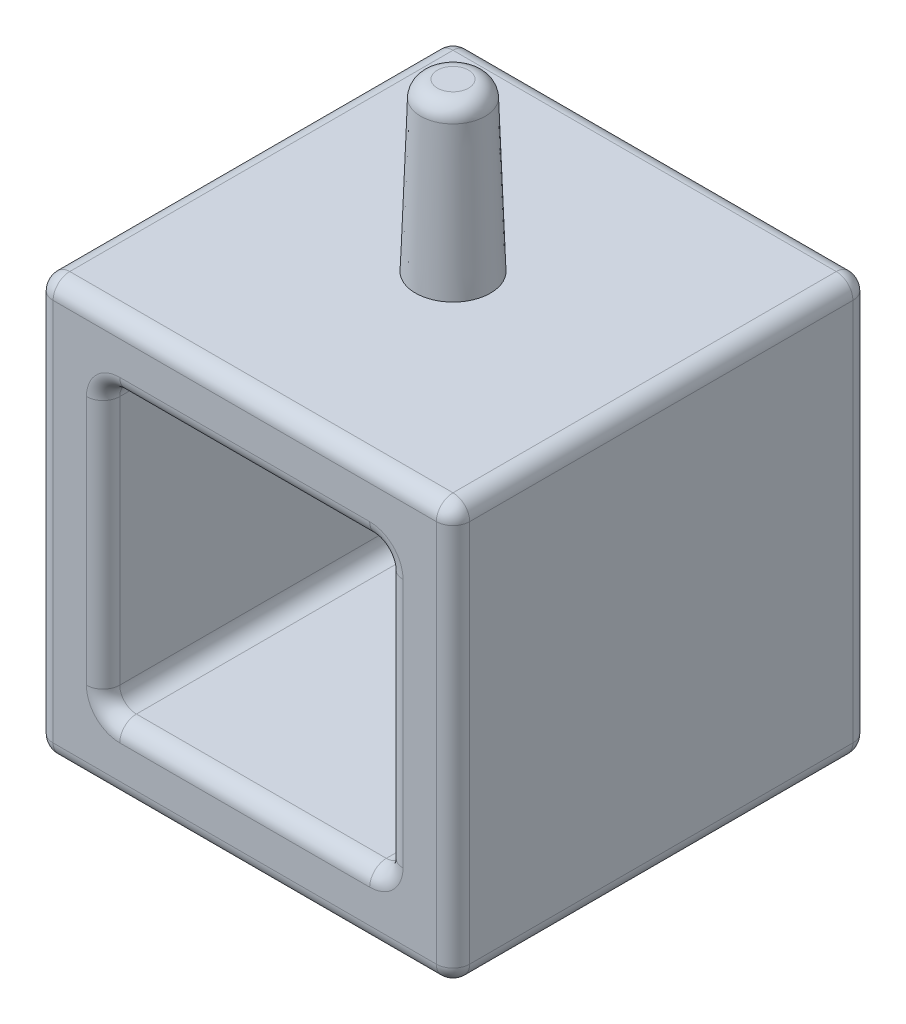
from build123d import *

# Parameters (mm, degrees)
SKETCH1_W           = 25
SKETCH1_H           = 25
BOSS_EXTRUDE1_DEPTH = 25
SKETCH3_R           = 2.25
BOSS_EXTRUDE2_DEPTH = 10
BOSS_EXTRUDE2_TAPER = 2
SKETCH4_R           = 2.25
BOSS_EXTRUDE3_DEPTH = 10
BOSS_EXTRUDE3_TAPER = 2
CUT_EXTRUDE1_DEPTH  = 25
FILLET1_R           = 1


with BuildPart() as part:
    # Sketch1 → Boss-Extrude1 (new body)
    with BuildSketch(Plane.XY):
        Rectangle(SKETCH1_W, SKETCH1_H)
    extrude(amount=BOSS_EXTRUDE1_DEPTH)

    # Sketch3 → Boss-Extrude2 (add)
    with BuildSketch(Plane.ZY.offset(12.5)):
        with Locations((12.5, 0)):
            Circle(SKETCH3_R)
    extrude(amount=BOSS_EXTRUDE2_DEPTH, taper=BOSS_EXTRUDE2_TAPER)

    # Sketch4 → Boss-Extrude3 (add)
    with BuildSketch(Plane(origin=(0, 12.5, 0), x_dir=(1, 0, 0), z_dir=(0, 1, 0))):
        with Locations((1e-09, -12.5)):
            Circle(SKETCH4_R)
    extrude(amount=BOSS_EXTRUDE3_DEPTH, taper=BOSS_EXTRUDE3_TAPER)

    # Sketch5 → Cut-Extrude1 (cut)
    with BuildSketch(Plane(origin=(0, 0, 0), x_dir=(-1, 0, 0), z_dir=(0, 0, -1))):
        with BuildLine():
            Line((-7.5, -8.5), (7.5, -8.5))
            ThreePointArc((7.5, -8.5), (8.207106781, -8.207106781), (8.5, -7.5))
            Line((8.5, -7.5), (8.5, 7.5))
            ThreePointArc((8.5, 7.5), (8.207106781, 8.207106781), (7.5, 8.5))
            Line((7.5, 8.5), (-7.5, 8.5))
            ThreePointArc((-7.5, 8.5), (-8.207106781, 8.207106781), (-8.5, 7.5))
            Line((-8.5, 7.5), (-8.5, -7.5))
            ThreePointArc((-8.5, -7.5), (-8.207106781, -8.207106781), (-7.5, -8.5))
        make_face()
    extrude(amount=-CUT_EXTRUDE1_DEPTH, mode=Mode.SUBTRACT)

    # Fillet1
    fillet1_edges = [part.edges().sort_by_distance(p)[0] for p in [
        (-12.5, 0, 25),
        (0, -12.5, 25),
        (-22.5, 0, 10.599207695),
        (-1.900792304, 22.5, 12.5),
        (8.207106781, -8.207106781, 0),
        (0, -8.5, 0),
        (-8.207106781, -8.207106781, 0),
        (-8.5, 0, 0),
        (-8.207106781, 8.207106781, 0),
        (0, 8.5, 0),
        (8.207106781, 8.207106781, 0),
        (8.5, 0, 0),
        (8.207106781, -8.207106781, 25),
        (8.5, 0, 25),
        (8.207106781, 8.207106781, 25),
        (0, 8.5, 25),
        (-8.207106781, 8.207106781, 25),
        (-8.5, 0, 25),
        (-8.207106781, -8.207106781, 25),
        (0, -8.5, 25),
        (12.5, 0, 25),
        (0, -12.5, 0),
        (-12.5, 0, 0),
        (0, 12.5, 0),
        (12.5, 0, 0),
        (0, 12.5, 25),
        (12.5, -12.5, 12.5),
        (-12.5, -12.5, 12.5),
        (-12.5, 12.5, 12.5),
        (12.5, 12.5, 12.5),
    ]]
    fillet(fillet1_edges, radius=FILLET1_R)


solid = part.part
